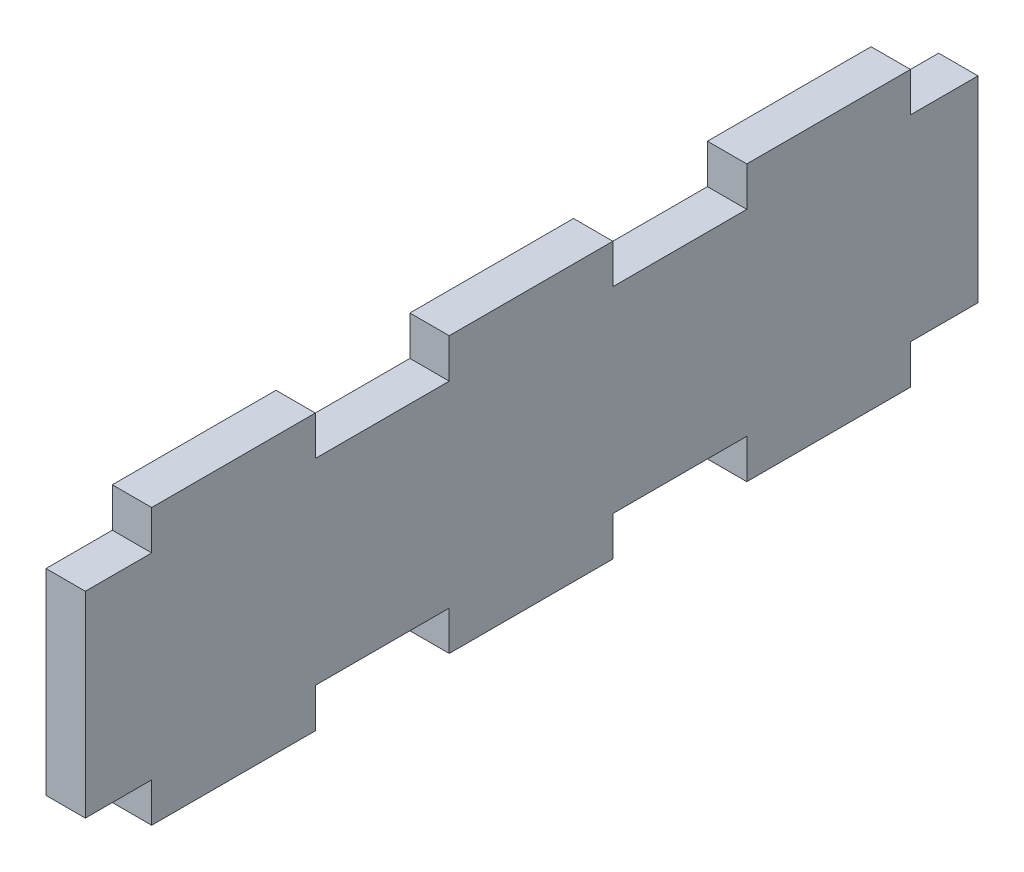
from build123d import *

# Parameters (mm, degrees)
SKETCH1_W           = 36
SKETCH1_H           = 11.1
BOSS_EXTRUDE1_DEPTH = 1.5875
SKETCH2_W           = 5.4
SKETCH2_H           = 1.5875
CUT_EXTRUDE1_DEPTH  = 19.902980089


with BuildPart() as part:
    # Sketch1 → Boss-Extrude1 (new body)
    with BuildSketch(Plane(origin=(0, 0, 0), x_dir=(0, 0, -1), z_dir=(1, 0, 0))):
        Rectangle(SKETCH1_W, SKETCH1_H)
    extrude(amount=BOSS_EXTRUDE1_DEPTH)

    # Sketch2 → Cut-Extrude1 (cut, through all)
    with BuildSketch(Plane(origin=(1.5875, 0, 0), x_dir=(0, 0, -1), z_dir=(1, 0, 0))):
        with Locations((5.975, 4.75625)):
            Rectangle(SKETCH2_W, SKETCH2_H)
        with Locations((17.975, 4.75625)):
            Rectangle(SKETCH2_W, SKETCH2_H)
        with Locations((-6.025, 4.75625)):
            Rectangle(SKETCH2_W, SKETCH2_H)
        with Locations((-18.025, 4.75625)):
            Rectangle(SKETCH2_W, SKETCH2_H)
    cut_extrude1 = extrude(amount=-CUT_EXTRUDE1_DEPTH, mode=Mode.SUBTRACT)

    # Mirror1: Cut-Extrude1 across plane
    add(cut_extrude1.mirror(Plane.ZX), mode=Mode.SUBTRACT)


solid = part.part
